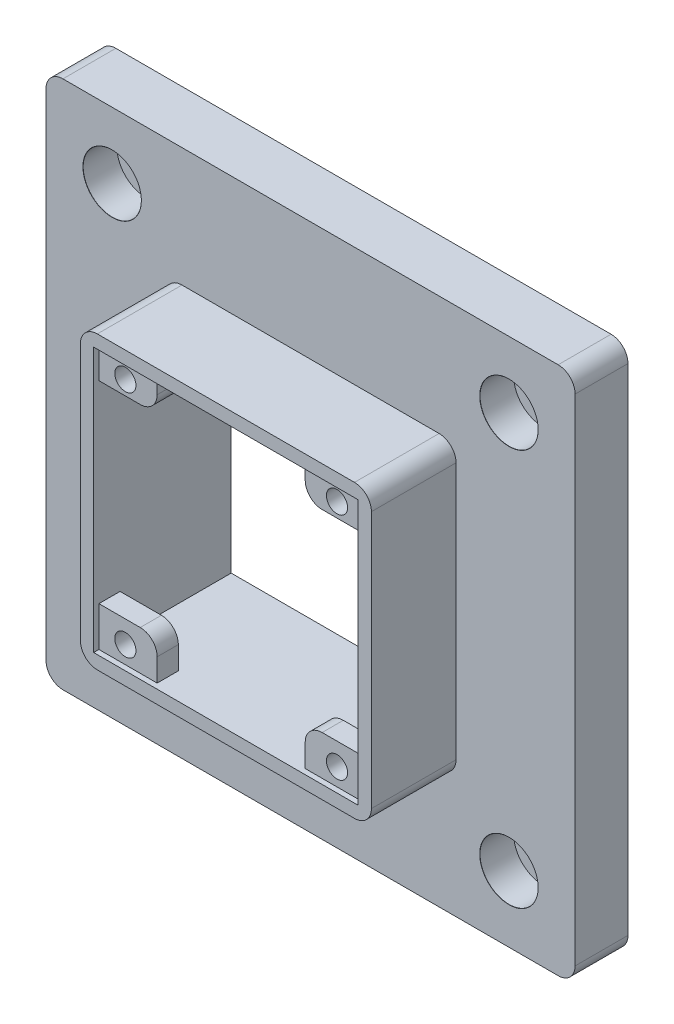
from build123d import *

# Parameters (mm, degrees)
SKETCH2_W                                    = 100
SKETCH2_H                                    = 100
SKETCH2_W_2                                  = 50
SKETCH2_H_2                                  = 50
BOSS_EXTRUDE1_DEPTH                          = 10
CBORE_FOR_M6_HEX_SOCKET_HEAD_CAP_SCR_2_COUNT = 2
CBORE_FOR_M6_HEX_SOCKET_HEAD_CAP_SCR_2_PITCH = 75
CBORE_FOR_M6_HEX_SOCKET_HEAD_CAP_SCR_3_COUNT = 2
CBORE_FOR_M6_HEX_SOCKET_HEAD_CAP_SCR_3_PITCH = 106.066017178
CBORE_FOR_M6_HEX_SOCKET_HEAD_CAP_SCR_4_COUNT = 2
CBORE_FOR_M6_HEX_SOCKET_HEAD_CAP_SCR_4_PITCH = 75
SKETCH7_W                                    = 55
SKETCH7_H                                    = 55
SKETCH7_W_2                                  = 50
SKETCH7_H_2                                  = 50
BOSS_EXTRUDE2_DEPTH                          = 16
SKETCH8_W                                    = 11.008814293
SKETCH8_H                                    = 6
SKETCH8_R                                    = 2
SKETCH8_H_2                                  = 7.5
BOSS_EXTRUDE3_DEPTH                          = 5
SKETCH9_W                                    = 11.008814293
SKETCH9_H                                    = 7.5
SKETCH9_R                                    = 2
SKETCH9_H_2                                  = 6
CUT_EXTRUDE1_DEPTH                           = 1
FILLET1_R                                    = 3.2


with BuildPart() as part:
    # Sketch2 → Boss-Extrude1 (new body)
    with BuildSketch(Plane(origin=(0, 0, 0), x_dir=(0, 1, 0), z_dir=(0, 0, 1))):
        Rectangle(SKETCH2_W, SKETCH2_H)
        Rectangle(SKETCH2_W_2, SKETCH2_H_2, mode=Mode.SUBTRACT)
    extrude(amount=BOSS_EXTRUDE1_DEPTH)

    # Sketch6 → CBORE for M6 Hex Socket Head Cap Screw1 (revolve, cut)
    with BuildSketch(Plane(origin=(-37.5, 37.5, 10), x_dir=(0, -1, 0), z_dir=(1, 0, 0))):
        Polygon((0, 0), (0, 10), (3.3, 10), (3.3, 6.4), (5.5, 6.4), (5.5, 0.025), (5.525, 0), align=None)
    cbore_for_m6_hex_socket_head_cap_screw1 = revolve(axis=Axis((-37.5, 37.5, 16.35), (0, 0, -1)), mode=Mode.SUBTRACT)

    # CBORE for M6 Hex Socket Head Cap Scr 2: CBORE for M6 Hex Socket Head Cap Screw1 ×2
    with Locations(*[(i * CBORE_FOR_M6_HEX_SOCKET_HEAD_CAP_SCR_2_PITCH, 0, 0) for i in range(1, CBORE_FOR_M6_HEX_SOCKET_HEAD_CAP_SCR_2_COUNT)]):
        add(cbore_for_m6_hex_socket_head_cap_screw1, mode=Mode.SUBTRACT)

    # CBORE for M6 Hex Socket Head Cap Scr 3: CBORE for M6 Hex Socket Head Cap Screw1 ×2
    with Locations(*[Vector(0.7071067811865477, -0.7071067811865475, 0) * (i * CBORE_FOR_M6_HEX_SOCKET_HEAD_CAP_SCR_3_PITCH) for i in range(1, CBORE_FOR_M6_HEX_SOCKET_HEAD_CAP_SCR_3_COUNT)]):
        add(cbore_for_m6_hex_socket_head_cap_screw1, mode=Mode.SUBTRACT)

    # CBORE for M6 Hex Socket Head Cap Scr 4: CBORE for M6 Hex Socket Head Cap Screw1 ×2
    with Locations(*[(0, -i * CBORE_FOR_M6_HEX_SOCKET_HEAD_CAP_SCR_4_PITCH, 0) for i in range(1, CBORE_FOR_M6_HEX_SOCKET_HEAD_CAP_SCR_4_COUNT)]):
        add(cbore_for_m6_hex_socket_head_cap_screw1, mode=Mode.SUBTRACT)

    # Sketch7 → Boss-Extrude2 (add)
    with BuildSketch(Plane.XY.offset(10)):
        Rectangle(SKETCH7_W, SKETCH7_H)
        Rectangle(SKETCH7_W_2, SKETCH7_H_2, mode=Mode.SUBTRACT)
    extrude(amount=BOSS_EXTRUDE2_DEPTH)

    # Sketch8 → Boss-Extrude3 (add)
    # profile 1 of 4: a face of its own
    with BuildSketch(Plane.XY.offset(26)):
        with Locations((-19.495592853, 22)):
            Rectangle(SKETCH8_W, SKETCH8_H)
        with Locations((-20, 21.7015)):
            Circle(SKETCH8_R, mode=Mode.SUBTRACT)
    # profile 2 of 4: a face of its own
    with BuildSketch(Plane.XY.offset(26)):
        with Locations((19.495592853, 22)):
            Rectangle(SKETCH8_W, SKETCH8_H)
        with Locations((20, 21.7015)):
            Circle(SKETCH8_R, mode=Mode.SUBTRACT)
    # profile 3 of 4: a face of its own
    with BuildSketch(Plane.XY.offset(26)):
        with Locations((19.495592853, -21.25)):
            Rectangle(SKETCH8_W, SKETCH8_H_2)
        with Locations((20, -21.7015)):
            Circle(SKETCH8_R, mode=Mode.SUBTRACT)
    # profile 4 of 4: a face of its own
    with BuildSketch(Plane.XY.offset(26)):
        with Locations((-19.495592853, -21.25)):
            Rectangle(SKETCH8_W, SKETCH8_H_2)
        with Locations((-20, -21.7015)):
            Circle(SKETCH8_R, mode=Mode.SUBTRACT)
    extrude(amount=-BOSS_EXTRUDE3_DEPTH)

    # Sketch9 → Cut-Extrude1 (cut)
    # profile 1 of 4: a face of its own
    with BuildSketch(Plane.XY.offset(26)):
        with Locations((-19.495592853, -21.25)):
            Rectangle(SKETCH9_W, SKETCH9_H)
        with Locations((-20, -21.7015)):
            Circle(SKETCH9_R, mode=Mode.SUBTRACT)
    # profile 2 of 4: a face of its own
    with BuildSketch(Plane.XY.offset(26)):
        with Locations((19.495592853, -21.25)):
            Rectangle(SKETCH9_W, SKETCH9_H)
    # profile 3 of 4: a face of its own
    with BuildSketch(Plane.XY.offset(26)):
        with Locations((19.495592853, 22)):
            Rectangle(SKETCH9_W, SKETCH9_H_2)
    # profile 4 of 4: a face of its own
    with BuildSketch(Plane.XY.offset(26)):
        with Locations((-19.495592853, 22)):
            Rectangle(SKETCH9_W, SKETCH9_H_2)
    extrude(amount=-CUT_EXTRUDE1_DEPTH, mode=Mode.SUBTRACT)

    # Fillet1
    fillet1_edges = [part.edges().sort_by_distance(p)[0] for p in [
        (-13.991185707, -17.5, 23),
        (13.991185707, -17.5, 23),
        (13.991185707, 19, 23),
        (-13.991185707, 19, 23),
        (-27.5, -27.5, 18),
        (27.5, -27.5, 18),
        (27.5, 27.5, 18),
        (50, -50, 5),
        (-27.5, 27.5, 18),
        (-50, -50, 5),
        (-50, 50, 5),
        (50, 50, 5),
    ]]
    fillet(fillet1_edges, radius=FILLET1_R)


solid = part.part
